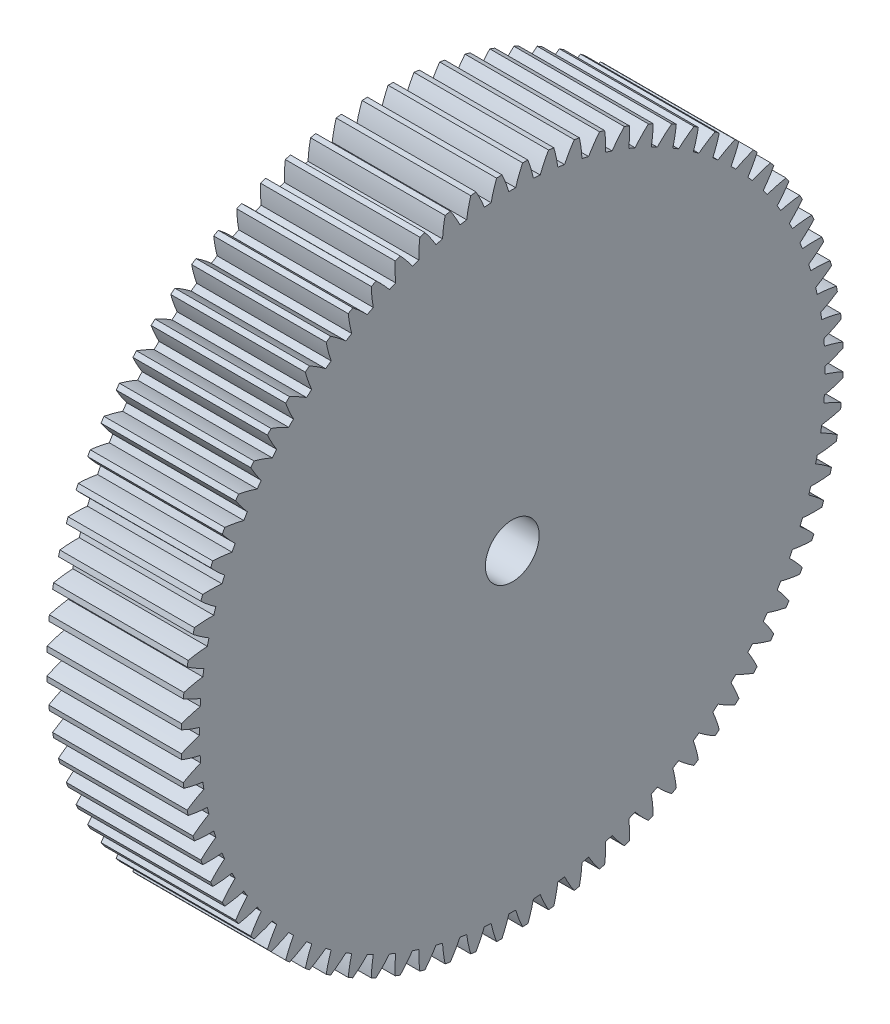
from build123d import *

# Parameters (mm, degrees)
BASPROSKE_W     = 10
BASPROSKE_H     = 24.6
TOOTHCUT_DEPTH  = 37.198342503
TEETHCUTS_COUNT = 80
TEETHCUTS_ANGLE = 355.5
BORSKE_R        = 2
BORE_DEPTH      = 50.0000508


with BuildPart() as part:
    # BasProSke → Base-Revolve (revolve)
    with BuildSketch(Plane(origin=(0, 0, 0), x_dir=(1, 0, 0), z_dir=(0, 1, 0)), mode=Mode.PRIVATE) as base_revolve_sk:
        with Locations((5, 12.3)):
            Rectangle(BASPROSKE_W, BASPROSKE_H)
    revolve(base_revolve_sk.sketch.rotate(Axis((-10, 0, 0), (1, 0, 0)), 180), axis=Axis((-10, 0, 0), (1, 0, 0)))

    # TooCutSke → ToothCut (cut, through all)
    with BuildSketch(Plane(origin=(0, 0, 0), x_dir=(0, 0, -1), z_dir=(1, 0, 0))):
        with BuildLine():
            ThreePointArc((0.252552306, 23.24762823), (0, 23.249), (-0.252552306, 23.24762823))
            ThreePointArc((-0.252552306, 23.24762823), (-0.490342662, 23.940404843), (-0.780259152, 24.613035587))
            ThreePointArc((-0.780259152, 24.613035587), (0, 24.6254), (0.780259152, 24.613035587))
            ThreePointArc((0.780259152, 24.613035587), (0.490342662, 23.940404843), (0.252552306, 23.24762823))
        make_face()
    toothcut = extrude(amount=TOOTHCUT_DEPTH, mode=Mode.SUBTRACT)

    # TeethCuts: ToothCut ×80 about axis
    teethcuts_axis = Axis((-10, 0, 0), (1, 0, 0))
    for i in range(1, TEETHCUTS_COUNT):
        add(toothcut.rotate(teethcuts_axis, i * TEETHCUTS_ANGLE / (TEETHCUTS_COUNT - 1)), mode=Mode.SUBTRACT)

    # BorSke → Bore (cut, symmetric)
    with BuildSketch(Plane(origin=(0, 0, 0), x_dir=(0, 0, -1), z_dir=(1, 0, 0))):
        with Locations(Location((0, 0, 0), (0, 0, 180))):
            Circle(BORSKE_R)
    extrude(amount=BORE_DEPTH, both=True, mode=Mode.SUBTRACT)


solid = part.part
